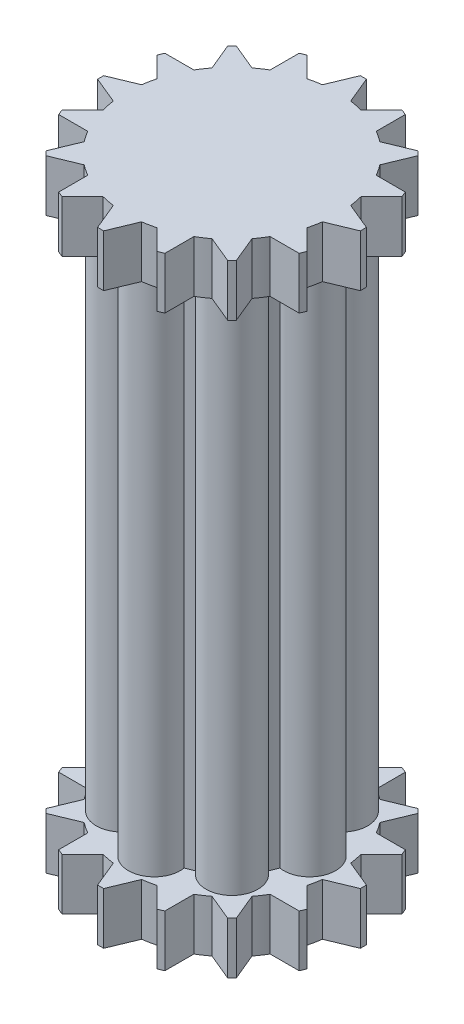
from build123d import *

# Parameters (mm, degrees)
BOSS_EXTRUDE2_DEPTH = 100
BOSS_EXTRUDE3_DEPTH = 10


with BuildPart() as part:
    # Sketch2 → Boss-Extrude2 (new body)
    with BuildSketch(Plane(origin=(0, 0, 0), x_dir=(-1, 0, 0), z_dir=(0, 1, 0))):
        with BuildLine():
            ThreePointArc((14.166666667, 4.930066486), (20, 0), (14.166666667, -4.930066486))
            ThreePointArc((14.166666667, -4.930066486), (13.858192988, -5.740251485), (13.503429511, -6.531262623))
            ThreePointArc((13.503429511, -6.531262623), (14.142135624, -14.142135624), (6.531262623, -13.503429511))
            ThreePointArc((6.531262623, -13.503429511), (5.740251485, -13.858192988), (4.930066486, -14.166666667))
            ThreePointArc((4.930066486, -14.166666667), (0, -20), (-4.930066486, -14.166666667))
            ThreePointArc((-4.930066486, -14.166666667), (-5.740251485, -13.858192988), (-6.531262623, -13.503429511))
            ThreePointArc((-6.531262623, -13.503429511), (-14.142135624, -14.142135624), (-13.503429511, -6.531262623))
            ThreePointArc((-13.503429511, -6.531262623), (-13.858192988, -5.740251485), (-14.166666667, -4.930066486))
            ThreePointArc((-14.166666667, -4.930066486), (-20, 0), (-14.166666667, 4.930066486))
            ThreePointArc((-14.166666667, 4.930066486), (-13.858192988, 5.740251485), (-13.503429511, 6.531262623))
            ThreePointArc((-13.503429511, 6.531262623), (-14.142135624, 14.142135624), (-6.531262623, 13.503429511))
            ThreePointArc((-6.531262623, 13.503429511), (-5.740251485, 13.858192988), (-4.930066486, 14.166666667))
            ThreePointArc((-4.930066486, 14.166666667), (0, 20), (4.930066486, 14.166666667))
            ThreePointArc((4.930066486, 14.166666667), (5.740251485, 13.858192988), (6.531262623, 13.503429511))
            ThreePointArc((6.531262623, 13.503429511), (14.142135624, 14.142135624), (13.503429511, 6.531262623))
            ThreePointArc((13.503429511, 6.531262623), (13.858192988, 5.740251485), (14.166666667, 4.930066486))
        make_face()
    extrude(amount=BOSS_EXTRUDE2_DEPTH)

    # Sketch3 → Boss-Extrude3 (add)
    with BuildSketch(Plane.XZ):
        with BuildLine():
            Line((-2.733, 20.190872591), (-0.588491123, 25.368175007))
            ThreePointArc((-0.588491123, 25.368175007), (0, 25.375), (0.588491123, 25.368175007))
            Line((0.588491123, 25.368175007), (2.733, 20.190872591))
            ThreePointArc((2.733, 20.190872591), (3.974965311, 19.983500088), (5.201749663, 19.699807751))
            Line((5.201749663, 19.699807751), (9.164285381, 23.662343469))
            ThreePointArc((9.164285381, 23.662343469), (9.710592096, 23.443443137), (10.251675188, 23.211931864))
            Line((10.251675188, 23.211931864), (10.251675188, 17.60806011))
            ThreePointArc((10.251675188, 17.60806011), (11.319743498, 16.941193351), (12.344580094, 16.20962576))
            Line((12.344580094, 16.20962576), (17.52188251, 18.354134638))
            ThreePointArc((17.52188251, 18.354134638), (17.942834573, 17.942834573), (18.354134638, 17.52188251))
            Line((18.354134638, 17.52188251), (16.20962576, 12.344580094))
            ThreePointArc((16.20962576, 12.344580094), (16.941193351, 11.319743498), (17.60806011, 10.251675188))
            Line((17.60806011, 10.251675188), (23.211931864, 10.251675188))
            ThreePointArc((23.211931864, 10.251675188), (23.443443137, 9.710592096), (23.662343469, 9.164285381))
            Line((23.662343469, 9.164285381), (19.699807751, 5.201749663))
            ThreePointArc((19.699807751, 5.201749663), (19.983500088, 3.974965311), (20.190872591, 2.733))
            Line((20.190872591, 2.733), (25.368175007, 0.588491123))
            ThreePointArc((25.368175007, 0.588491123), (25.375, 0), (25.368175007, -0.588491123))
            Line((25.368175007, -0.588491123), (20.190872591, -2.733))
            ThreePointArc((20.190872591, -2.733), (19.983500088, -3.974965311), (19.699807751, -5.201749663))
            Line((19.699807751, -5.201749663), (23.662343469, -9.164285381))
            ThreePointArc((23.662343469, -9.164285381), (23.443443137, -9.710592096), (23.211931864, -10.251675188))
            Line((23.211931864, -10.251675188), (17.60806011, -10.251675188))
            ThreePointArc((17.60806011, -10.251675188), (16.941193351, -11.319743498), (16.20962576, -12.344580094))
            Line((16.20962576, -12.344580094), (18.354134638, -17.52188251))
            ThreePointArc((18.354134638, -17.52188251), (17.942834573, -17.942834573), (17.52188251, -18.354134638))
            Line((17.52188251, -18.354134638), (12.344580094, -16.20962576))
            ThreePointArc((12.344580094, -16.20962576), (11.319743498, -16.941193351), (10.251675188, -17.60806011))
            Line((10.251675188, -17.60806011), (10.251675188, -23.211931864))
            ThreePointArc((10.251675188, -23.211931864), (9.710592096, -23.443443137), (9.164285381, -23.662343469))
            Line((9.164285381, -23.662343469), (5.201749663, -19.699807751))
            ThreePointArc((5.201749663, -19.699807751), (3.974965311, -19.983500088), (2.733, -20.190872591))
            Line((2.733, -20.190872591), (0.588491123, -25.368175007))
            ThreePointArc((0.588491123, -25.368175007), (0, -25.375), (-0.588491123, -25.368175007))
            Line((-0.588491123, -25.368175007), (-2.733, -20.190872591))
            ThreePointArc((-2.733, -20.190872591), (-3.974965311, -19.983500088), (-5.201749663, -19.699807751))
            Line((-5.201749663, -19.699807751), (-9.164285381, -23.662343469))
            ThreePointArc((-9.164285381, -23.662343469), (-9.710592096, -23.443443137), (-10.251675188, -23.211931864))
            Line((-10.251675188, -23.211931864), (-10.251675188, -17.60806011))
            ThreePointArc((-10.251675188, -17.60806011), (-11.319743498, -16.941193351), (-12.344580094, -16.20962576))
            Line((-12.344580094, -16.20962576), (-17.52188251, -18.354134638))
            ThreePointArc((-17.52188251, -18.354134638), (-17.942834573, -17.942834573), (-18.354134638, -17.52188251))
            Line((-18.354134638, -17.52188251), (-16.20962576, -12.344580094))
            ThreePointArc((-16.20962576, -12.344580094), (-16.941193351, -11.319743498), (-17.60806011, -10.251675188))
            Line((-17.60806011, -10.251675188), (-23.211931864, -10.251675188))
            ThreePointArc((-23.211931864, -10.251675188), (-23.443443137, -9.710592096), (-23.662343469, -9.164285381))
            Line((-23.662343469, -9.164285381), (-19.699807751, -5.201749663))
            ThreePointArc((-19.699807751, -5.201749663), (-19.983500088, -3.974965311), (-20.190872591, -2.733))
            Line((-20.190872591, -2.733), (-25.368175007, -0.588491123))
            ThreePointArc((-25.368175007, -0.588491123), (-25.375, 0), (-25.368175007, 0.588491123))
            Line((-25.368175007, 0.588491123), (-20.190872591, 2.733))
            ThreePointArc((-20.190872591, 2.733), (-19.983500088, 3.974965311), (-19.699807751, 5.201749663))
            Line((-19.699807751, 5.201749663), (-23.662343469, 9.164285381))
            ThreePointArc((-23.662343469, 9.164285381), (-23.443443137, 9.710592096), (-23.211931864, 10.251675188))
            Line((-23.211931864, 10.251675188), (-17.60806011, 10.251675188))
            ThreePointArc((-17.60806011, 10.251675188), (-16.941193351, 11.319743498), (-16.20962576, 12.344580094))
            Line((-16.20962576, 12.344580094), (-18.354134638, 17.52188251))
            ThreePointArc((-18.354134638, 17.52188251), (-17.942834573, 17.942834573), (-17.52188251, 18.354134638))
            Line((-17.52188251, 18.354134638), (-12.344580094, 16.20962576))
            ThreePointArc((-12.344580094, 16.20962576), (-11.319743498, 16.941193351), (-10.251675188, 17.60806011))
            Line((-10.251675188, 17.60806011), (-10.251675188, 23.211931864))
            ThreePointArc((-10.251675188, 23.211931864), (-9.710592096, 23.443443137), (-9.164285381, 23.662343469))
            Line((-9.164285381, 23.662343469), (-5.201749663, 19.699807751))
            ThreePointArc((-5.201749663, 19.699807751), (-3.974965311, 19.983500088), (-2.733, 20.190872591))
        make_face()
    boss_extrude3 = extrude(amount=BOSS_EXTRUDE3_DEPTH)

    # Mirror1: Boss-Extrude3 across plane
    add(boss_extrude3.mirror(Plane.ZX.offset(50)))


solid = part.part
